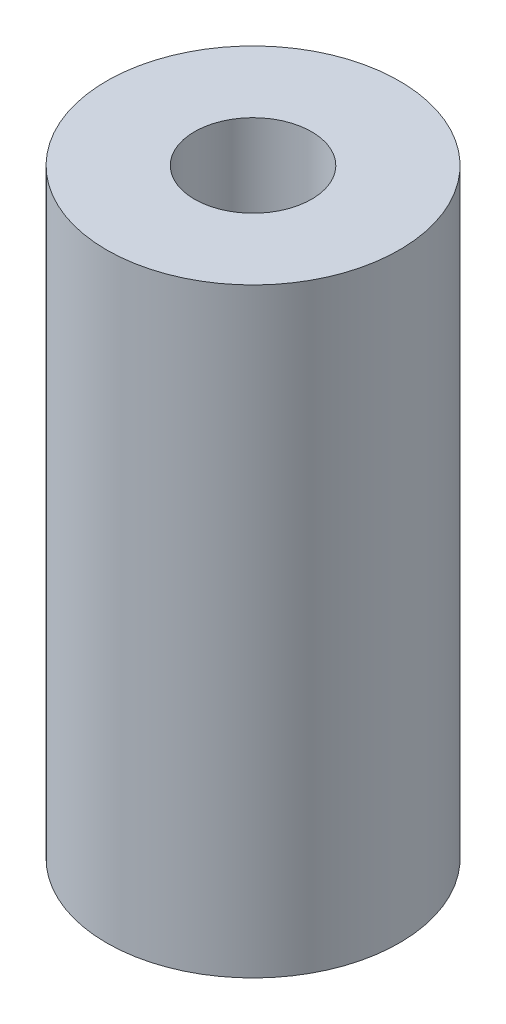
from build123d import *

# Parameters (mm, degrees)
SKETCH_1_R      = 5
SKETCH_1_R_2    = 2
EXTRUDE_1_DEPTH = 20.5


with BuildPart() as part:
    # Эскиз1 → Бобышка-Вытянуть1 (new body)
    with BuildSketch(Plane(origin=(0, 0, 0), x_dir=(1, 0, 0), z_dir=(0, 1, 0))):
        with Locations(Location((0, 0, 0), (0, 0, 270))):
            Circle(SKETCH_1_R)
        with Locations(Location((0, 0, 0), (0, 0, 270))):
            Circle(SKETCH_1_R_2, mode=Mode.SUBTRACT)
    extrude(amount=EXTRUDE_1_DEPTH)


solid = part.part
